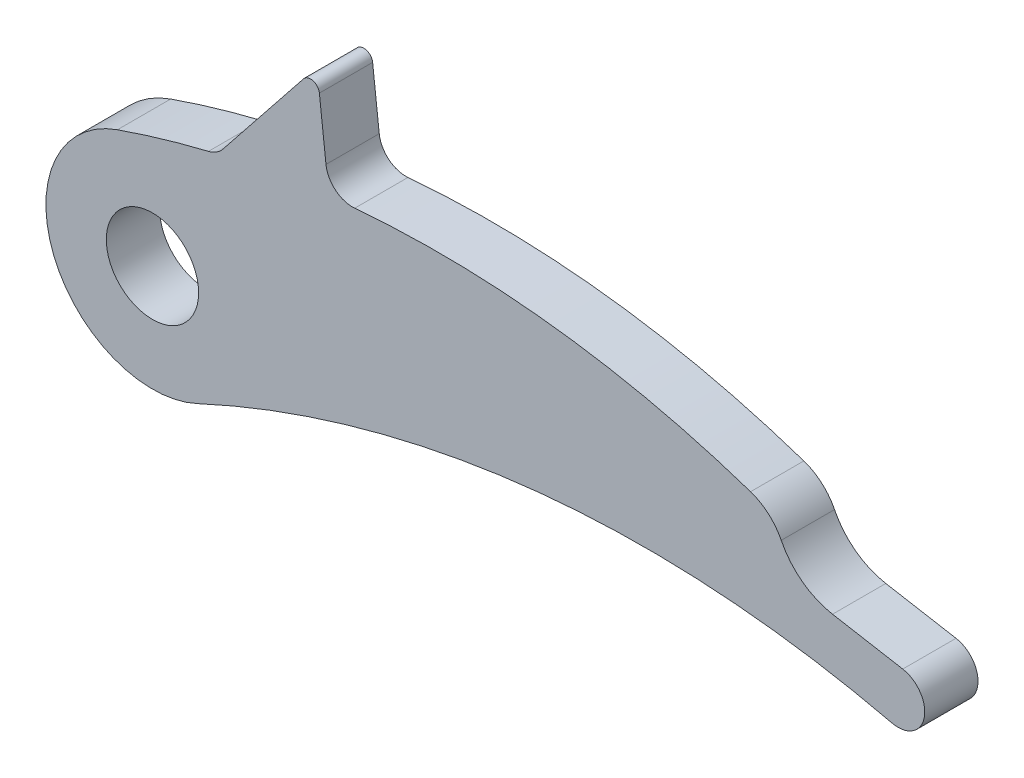
from build123d import *

# Parameters (mm, degrees)
ESQUISSE1_R          = 2.6
BASE_EXTRUSION_DEPTH = 3


with BuildPart() as part:
    # Esquisse1 → Base-Extrusion (new body)
    with BuildSketch(Plane.XY):
        with BuildLine():
            Line((42.260472267, 1.47721163), (38.305407289, 2.174596295))
            ThreePointArc((38.305407289, 2.174596295), (36.604258385, 2.910637942), (35.417544816, 4.334497417))
            ThreePointArc((35.417544816, 4.334497417), (34.703252614, 5.26032071), (33.689272741, 5.842735456))
            ThreePointArc((33.689272741, 5.842735456), (22.679517475, 8.332820348), (11.393281032, 8.522822221))
            ThreePointArc((11.393281032, 8.522822221), (10.314139297, 8.856754257), (9.773978095, 9.848864818))
            Line((9.773978095, 9.848864818), (9.402019506, 13.140725264))
            ThreePointArc((9.402019506, 13.140725264), (9.043446847, 13.565088236), (8.514166767, 13.396206973))
            Line((8.514166767, 13.396206973), (3.974497387, 7.699944601))
            ThreePointArc((3.974497387, 7.699944601), (3.608247601, 7.370259002), (3.154924555, 7.177050008))
            ThreePointArc((3.154924555, 7.177050008), (0.572430777, 6.483979152), (-1.973326778, 5.666214029))
            ThreePointArc((-1.973326778, 5.666214029), (-5.560323829, -2.254506357), (2.530032468, -5.440490393))
            ThreePointArc((2.530032468, -5.440490393), (21.756803647, -0.153586273), (41.654398955, -1.459643764))
            ThreePointArc((41.654398955, -1.459643764), (43.469044461, -0.303163936), (42.260472267, 1.47721163))
        make_face()
        Circle(ESQUISSE1_R, mode=Mode.SUBTRACT)
    extrude(amount=BASE_EXTRUSION_DEPTH)


solid = part.part
